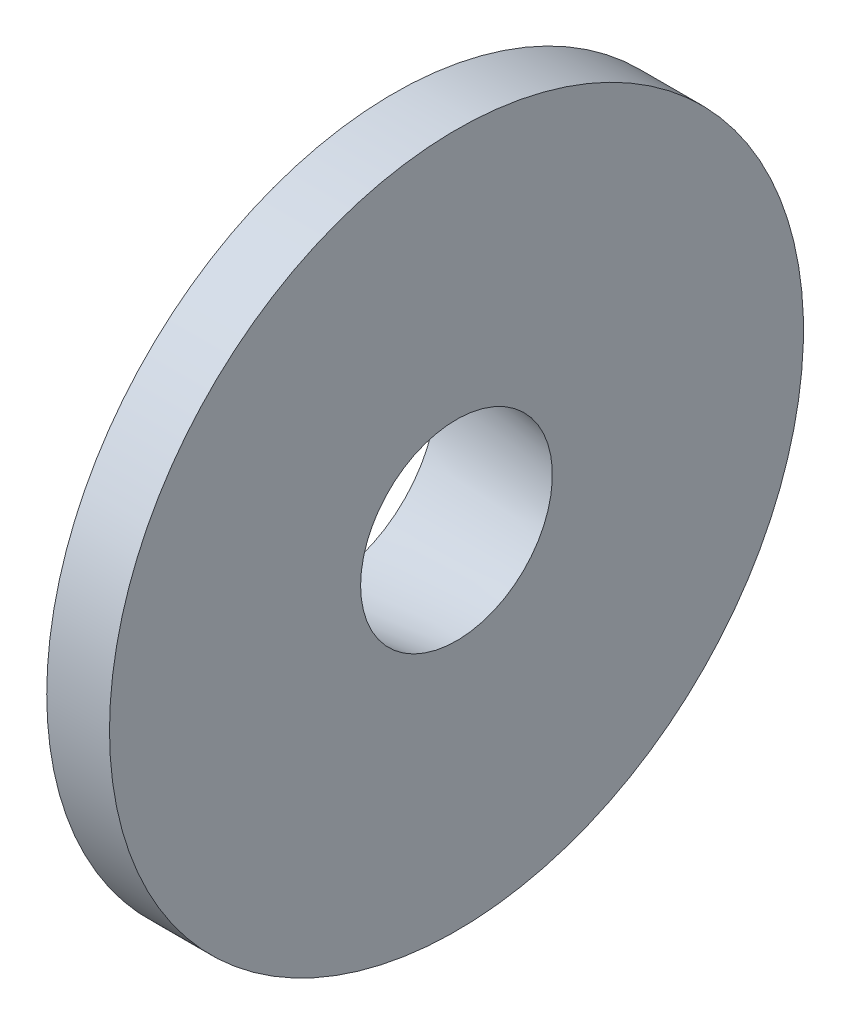
from build123d import *


with BuildPart() as part:
    # Esquisse1 → Révolution1 (revolve)
    with BuildSketch(Plane(origin=(191.924039025, -30.484219269, 0), x_dir=(1, 0, 0), z_dir=(0, 0, 1)), mode=Mode.PRIVATE) as r_volution1_sk:
        Polygon((-191.924039025, 48.384219269), (-191.924039025, 62.384219269), (-180.924039025, 85.759219269), (-170.924039025, 85.759219269), (-170.924039025, 45.759219269), align=None)
    revolve(r_volution1_sk.sketch.rotate(Axis((138.595599426, 0, 0), (1, 0, 0)), 90), axis=Axis((138.595599426, 0, 0), (1, 0, 0)))


solid = part.part
